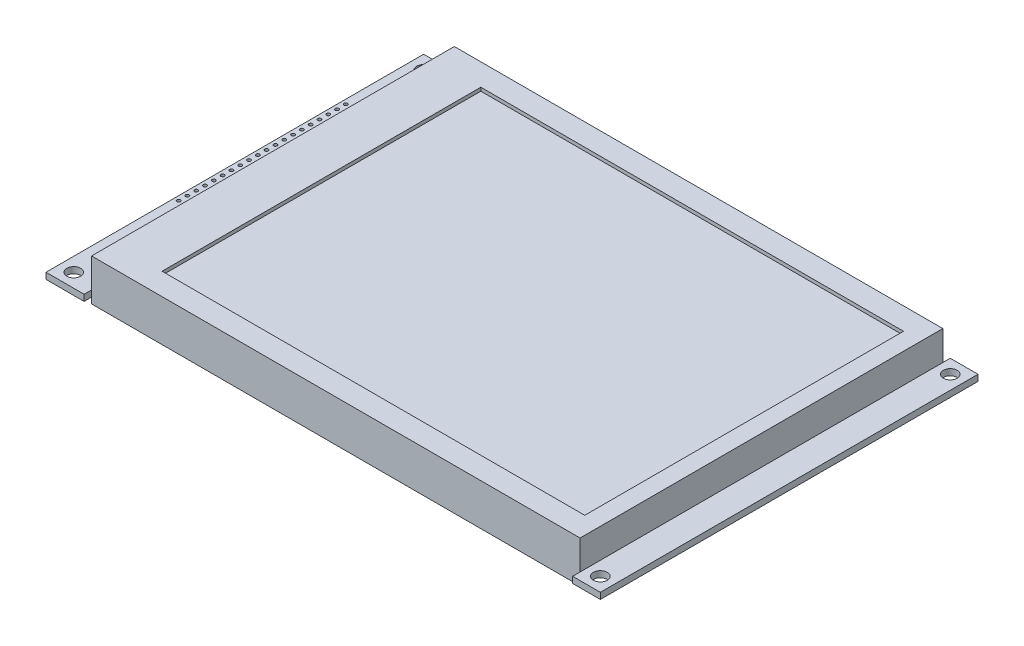
from build123d import *

# Parameters (mm, degrees)
SKETCH_1_W          = 160
SKETCH_1_H          = 109
EXTRUDE_1_DEPTH     = 1.8
SKETCH_2_R          = 2
CUT_EXTRUDE_1_DEPTH = 97.816785735
SKETCH_3_W          = 141
SKETCH_3_H          = 2.15
CUT_EXTRUDE_3_DEPTH = 97.816785735
SKETCH_4_W          = 141
SKETCH_4_H          = 104.7
EXTRUDE_2_DEPTH     = 8.5
SKETCH_5_W          = 122
SKETCH_5_H          = 92
CUT_EXTRUDE_4_DEPTH = 1
SKETCH_6_R          = 0.5
CUT_EXTRUDE_5_DEPTH = 98.172526982
SKETCH_7_W          = 141
SKETCH_7_H          = 104.7
EXTRUDE_3_DEPTH     = 1.7


with BuildPart() as part:
    # 草图1 → 拉伸1 (new body)
    with BuildSketch(Plane(origin=(0, 0, 0), x_dir=(1, 0, 0), z_dir=(0, 1, 0))):
        Rectangle(SKETCH_1_W, SKETCH_1_H)
    extrude(amount=EXTRUDE_1_DEPTH)

    # 草图2 → 切除-拉伸1 (cut, through all)
    with BuildSketch(Plane(origin=(0, 1.8, 0), x_dir=(-1, 0, 0), z_dir=(0, 1, 0))):
        with Locations(Location((-76, -50.5, 0), (0, 0, 90))):
            Circle(SKETCH_2_R)
        with Locations(Location((-76, 50.5, 0), (0, 0, 90))):
            Circle(SKETCH_2_R)
        with Locations(Location((76, 50.5, 0), (0, 0, 90))):
            Circle(SKETCH_2_R)
        with Locations(Location((76, -50.5, 0), (0, 0, 90))):
            Circle(SKETCH_2_R)
    extrude(amount=-CUT_EXTRUDE_1_DEPTH, mode=Mode.SUBTRACT)

    # 草图3 → 切除-拉伸3 (cut, through all)
    with BuildSketch(Plane(origin=(0, 1.8, 0), x_dir=(-1, 0, 0), z_dir=(0, 1, 0))):
        with Locations((-1.5, -53.425)):
            Rectangle(SKETCH_3_W, SKETCH_3_H)
        with Locations((-1.5, 53.425)):
            Rectangle(SKETCH_3_W, SKETCH_3_H)
    extrude(amount=-CUT_EXTRUDE_3_DEPTH, mode=Mode.SUBTRACT)

    # 草图4 → 拉伸2 (add)
    with BuildSketch(Plane(origin=(0, 1.8, 0), x_dir=(-1, 0, 0), z_dir=(0, 1, 0))):
        with Locations((-1.5, 0)):
            Rectangle(SKETCH_4_W, SKETCH_4_H)
    extrude(amount=EXTRUDE_2_DEPTH)

    # 草图5 → 切除-拉伸4 (cut)
    with BuildSketch(Plane(origin=(0, 10.3, 0), x_dir=(-1, 0, 0), z_dir=(0, 1, 0))):
        with Locations((-6, 0)):
            Rectangle(SKETCH_5_W, SKETCH_5_H)
    extrude(amount=-CUT_EXTRUDE_4_DEPTH, mode=Mode.SUBTRACT)

    # 草图6 → 切除-拉伸5 (cut, through all)
    with BuildSketch(Plane(origin=(0, 1.8, 0), x_dir=(-1, 0, 0), z_dir=(0, 1, 0))):
        with Locations(Location((78.72, 17.5, 0), (0, 0, 90))):
            Circle(SKETCH_6_R)
        with Locations(Location((78.72, 14.96, 0), (0, 0, 90))):
            Circle(SKETCH_6_R)
        with Locations(Location((78.72, 12.42, 0), (0, 0, 90))):
            Circle(SKETCH_6_R)
        with Locations(Location((78.72, 9.88, 0), (0, 0, 90))):
            Circle(SKETCH_6_R)
        with Locations(Location((78.72, 7.34, 0), (0, 0, 90))):
            Circle(SKETCH_6_R)
        with Locations(Location((78.72, 4.8, 0), (0, 0, 90))):
            Circle(SKETCH_6_R)
        with Locations(Location((78.72, 2.26, 0), (0, 0, 90))):
            Circle(SKETCH_6_R)
        with Locations(Location((78.72, -0.28, 0), (0, 0, 90))):
            Circle(SKETCH_6_R)
        with Locations(Location((78.72, -2.82, 0), (0, 0, 90))):
            Circle(SKETCH_6_R)
        with Locations(Location((78.72, -5.36, 0), (0, 0, 90))):
            Circle(SKETCH_6_R)
        with Locations(Location((78.72, -7.9, 0), (0, 0, 90))):
            Circle(SKETCH_6_R)
        with Locations(Location((78.72, -10.44, 0), (0, 0, 90))):
            Circle(SKETCH_6_R)
        with Locations(Location((78.72, -12.98, 0), (0, 0, 90))):
            Circle(SKETCH_6_R)
        with Locations(Location((78.72, -15.52, 0), (0, 0, 90))):
            Circle(SKETCH_6_R)
        with Locations(Location((78.72, -18.06, 0), (0, 0, 90))):
            Circle(SKETCH_6_R)
        with Locations(Location((78.72, -20.6, 0), (0, 0, 90))):
            Circle(SKETCH_6_R)
        with Locations(Location((78.72, -23.14, 0), (0, 0, 90))):
            Circle(SKETCH_6_R)
        with Locations(Location((78.72, -25.68, 0), (0, 0, 90))):
            Circle(SKETCH_6_R)
        with Locations(Location((78.72, -28.22, 0), (0, 0, 90))):
            Circle(SKETCH_6_R)
        with Locations(Location((78.72, -30.76, 0), (0, 0, 90))):
            Circle(SKETCH_6_R)
    extrude(amount=-CUT_EXTRUDE_5_DEPTH, mode=Mode.SUBTRACT)

    # 草图7 → 拉伸3 (add)
    with BuildSketch(Plane.XZ):
        with Locations((1.5, 0)):
            Rectangle(SKETCH_7_W, SKETCH_7_H)
    extrude(amount=EXTRUDE_3_DEPTH)


solid = part.part
